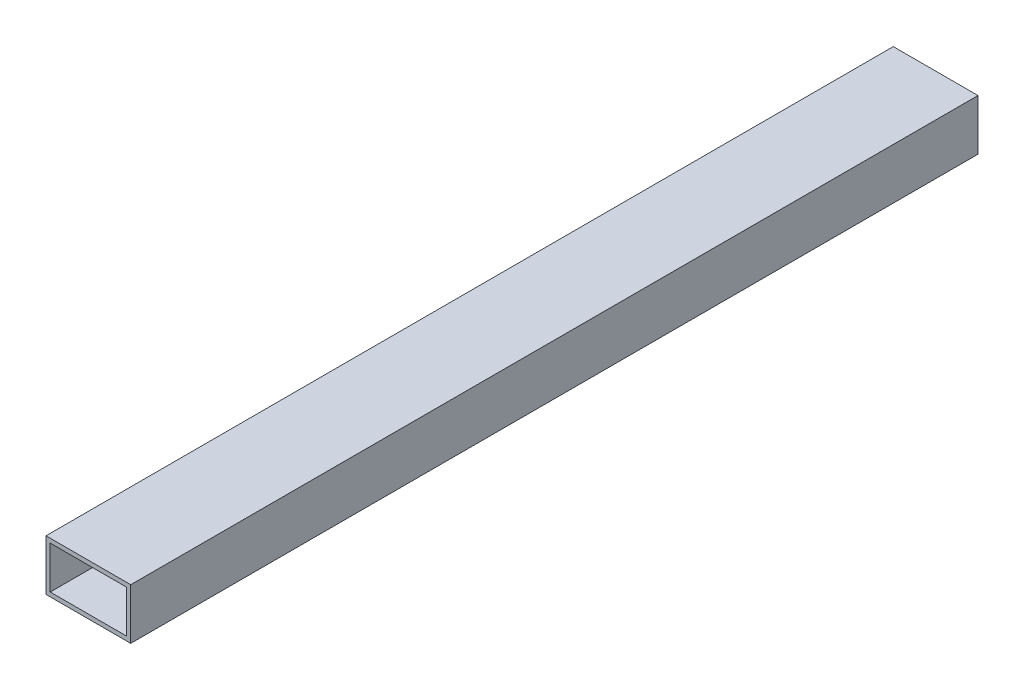
from build123d import *

# Parameters (mm, degrees)
SKETCH1_W           = 50
SKETCH1_H           = 30
SKETCH1_W_2         = 45
SKETCH1_H_2         = 25
BOSS_EXTRUDE1_DEPTH = 250


with BuildPart() as part:
    # Sketch1 → Boss-Extrude1 (new, symmetric)
    with BuildSketch(Plane.XY):
        Rectangle(SKETCH1_W, SKETCH1_H)
        Rectangle(SKETCH1_W_2, SKETCH1_H_2, mode=Mode.SUBTRACT)
    extrude(amount=BOSS_EXTRUDE1_DEPTH, both=True)


solid = part.part
